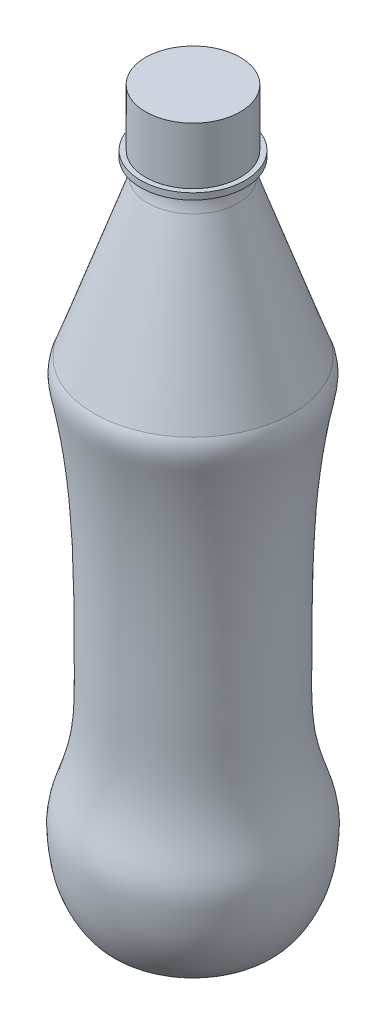
from build123d import *


with BuildPart() as part:
    # Sketch2 → Revolve2 (revolve)
    with BuildSketch(Plane.XY, mode=Mode.PRIVATE) as revolve2_sk:
        with BuildLine():
            Line((0, 168.903192951), (15, 168.903192951))
            Line((15, 168.903192951), (15, 150.903192951))
            Line((15, 150.903192951), (16.6, 150.903192951))
            Line((16.6, 150.903192951), (16.6, 148.903192951))
            Line((16.6, 148.903192951), (13.5, 148.903192951))
            add(Edge.make_bspline(
                [(13.5, 148.903192951), (13.434542306, 147.062564488), (13.708566417, 145.26063883), (14.322072332, 143.497415977)],
                knots=[0, 0, 0, 0, 1, 1, 1, 1], degree=3))
            Line((14.322072332, 143.497415977), (31.45, 94.271560556))
            add(Edge.make_bspline(
                [(31.45, 94.271560556), (33.229126476, 90.845001817), (26.551628462, 62.433806412), (26.823939199, 27.642446291), (26.534878828, -7.980277801), (29.779872762, -21.167076085), (32.957402386, -29.251025192), (32.695362988, -40.354526378), (31.042317735, -50.939796111), (22.16798563, -63.145599506), (13.030739968, -58.723683942), (6.82762256, -55.368152541), (1.956337431, -55.2690346), (0, -55.33481547)],
                knots=[0, 0, 0, 0, 0.05780284, 0.472965333, 0.582837644, 0.639270184, 0.696109455, 0.72354797, 0.819702818, 0.882564852, 0.920543744, 0.968756394, 1, 1, 1, 1], degree=3))
            Line((0, -55.33481547), (0, 168.903192951))
        make_face()
    revolve(revolve2_sk.sketch.rotate(Axis((0, 168.903192951, 0), (0, -1, 0)), 180), axis=Axis((0, 168.903192951, 0), (0, -1, 0)))


solid = part.part
